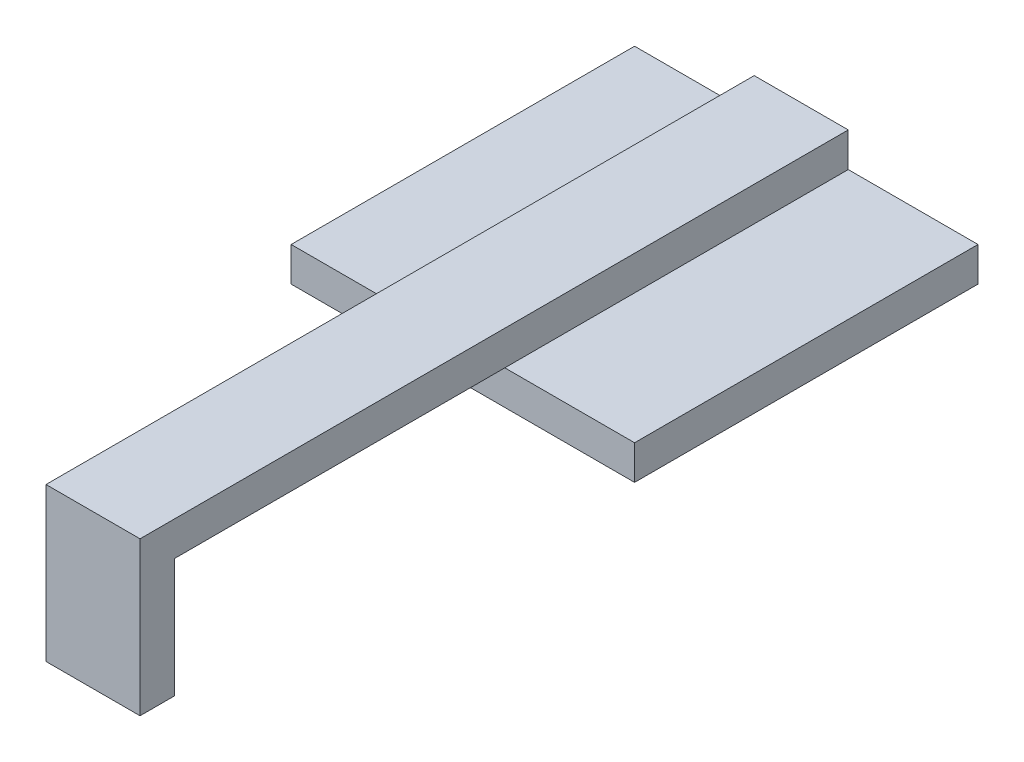
from build123d import *

# Parameters (mm, degrees)
CROQUIS1_W              = 30
CROQUIS1_H              = 30
SALIENTE_EXTRUIR1_DEPTH = 3
CROQUIS2_W              = 8.214533593
CROQUIS2_H              = 58.866686573
SALIENTE_EXTRUIR2_DEPTH = 3
CROQUIS3_W              = 8.214533593
CROQUIS3_H              = 13.391786962
SALIENTE_EXTRUIR3_DEPTH = 3


with BuildPart() as part:
    # Croquis1 → Saliente-Extruir1 (new body)
    with BuildSketch(Plane(origin=(0, 0, 0), x_dir=(1, 0, 0), z_dir=(0, 1, 0))):
        Rectangle(CROQUIS1_W, CROQUIS1_H)
    extrude(amount=SALIENTE_EXTRUIR1_DEPTH)

    # Croquis2 → Saliente-Extruir2 (add)
    with BuildSketch(Plane(origin=(0, 3, 0), x_dir=(1, 0, 0), z_dir=(0, 1, 0))):
        with Locations((-0.441980957, -14.433343287)):
            Rectangle(CROQUIS2_W, CROQUIS2_H)
    extrude(amount=SALIENTE_EXTRUIR2_DEPTH)

    # Croquis3 → Saliente-Extruir3 (add)
    with BuildSketch(Plane.XY.offset(43.866686573)):
        with Locations((-0.441980957, -0.695893481)):
            Rectangle(CROQUIS3_W, CROQUIS3_H)
    extrude(amount=SALIENTE_EXTRUIR3_DEPTH)


solid = part.part
